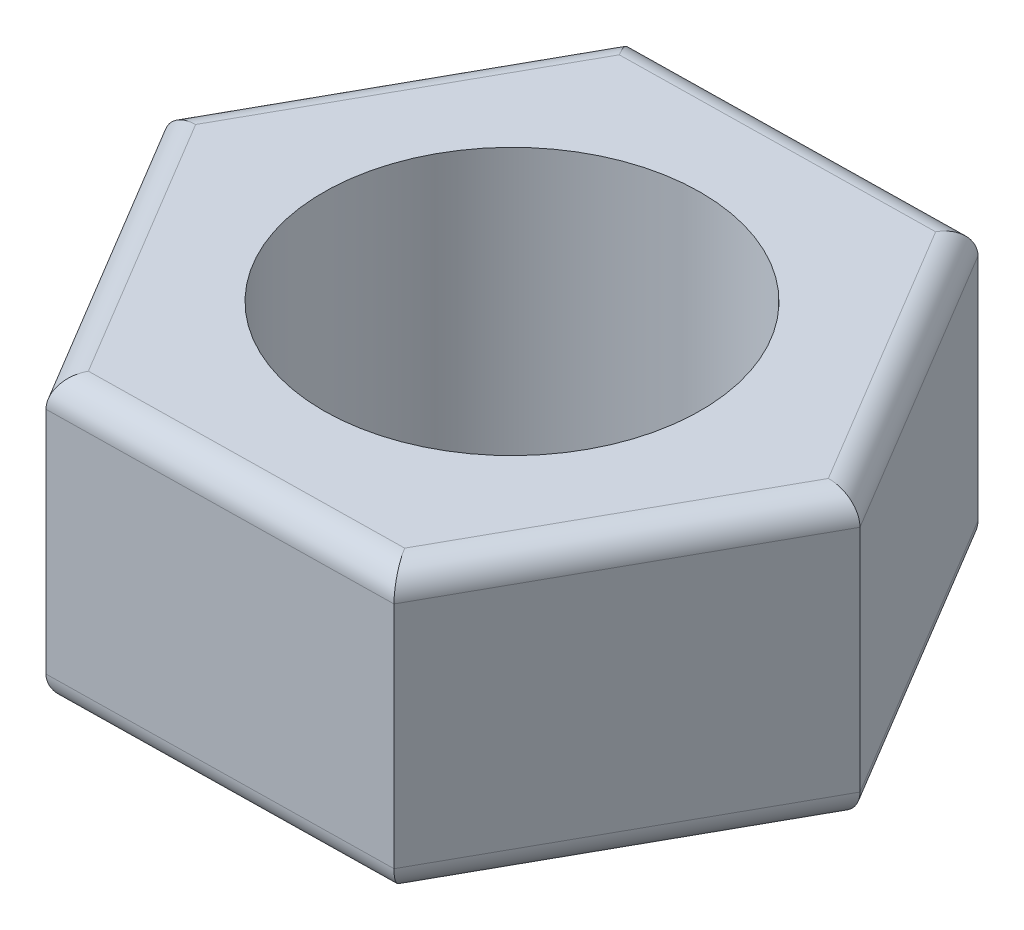
from build123d import *

# Parameters (mm, degrees)
SKETCH_1_R      = 7
EXTRUDE_1_DEPTH = 10.5
FILLET_1_R      = 1


with BuildPart() as part:
    # Эскиз1 → Вытянуть1 (new body)
    with BuildSketch(Plane(origin=(0, 0, 0), x_dir=(1, 0, 0), z_dir=(0, 1, 0))):
        Polygon((6.523683625, -10.898389115), (12.700123646, 0.200481188), (6.176440021, 11.098870303), (-6.523683625, 10.898389115), (-12.700123646, -0.200481188), (-6.176440021, -11.098870303), align=None)
        with Locations(Location((0, 0, 0), (0, 0, 90))):
            Circle(SKETCH_1_R, mode=Mode.SUBTRACT)
    extrude(amount=EXTRUDE_1_DEPTH)

    # Скругление1
    fillet_1_edges = [part.edges().sort_by_distance(p)[0] for p in [
        (9.438281834, 10.5, -5.649675745),
        (-0.173621802, 10.5, -10.998629709),
        (-9.611903636, 10.5, -5.348953963),
        (-9.438281834, 10.5, 5.649675745),
        (0.173621802, 10.5, 10.998629709),
        (-9.438281834, 0, 5.649675745),
        (-9.611903636, 0, -5.348953963),
        (-0.173621802, 0, -10.998629709),
        (9.611903636, 10.5, 5.348953963),
        (9.438281834, 0, -5.649675745),
        (9.611903636, 0, 5.348953963),
        (0.173621802, 0, 10.998629709),
    ]]
    fillet(fillet_1_edges, radius=FILLET_1_R)


solid = part.part
